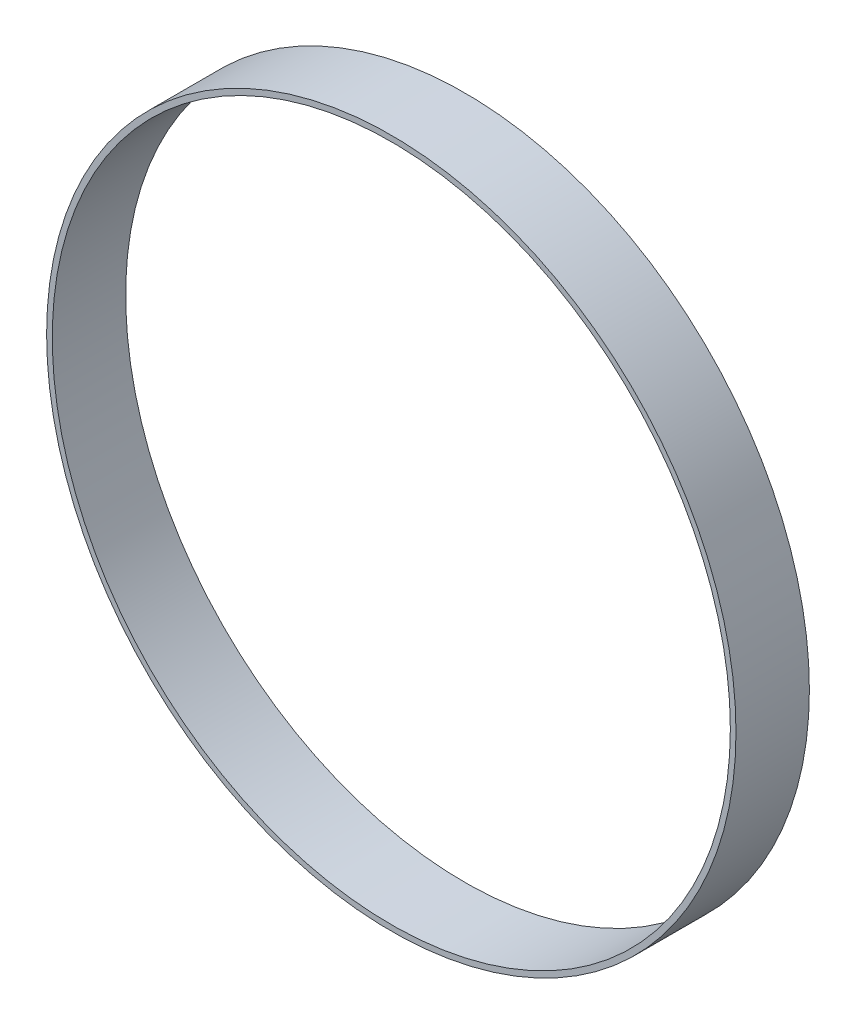
from build123d import *

# Parameters (mm, degrees)
SKETCH1_R           = 775.335
SKETCH1_R_2         = 762.635
BOSS_EXTRUDE1_DEPTH = 165.1


with BuildPart() as part:
    # Sketch1 → Boss-Extrude1 (new body)
    with BuildSketch(Plane.XY):
        Circle(SKETCH1_R)
        Circle(SKETCH1_R_2, mode=Mode.SUBTRACT)
    extrude(amount=BOSS_EXTRUDE1_DEPTH)


solid = part.part
